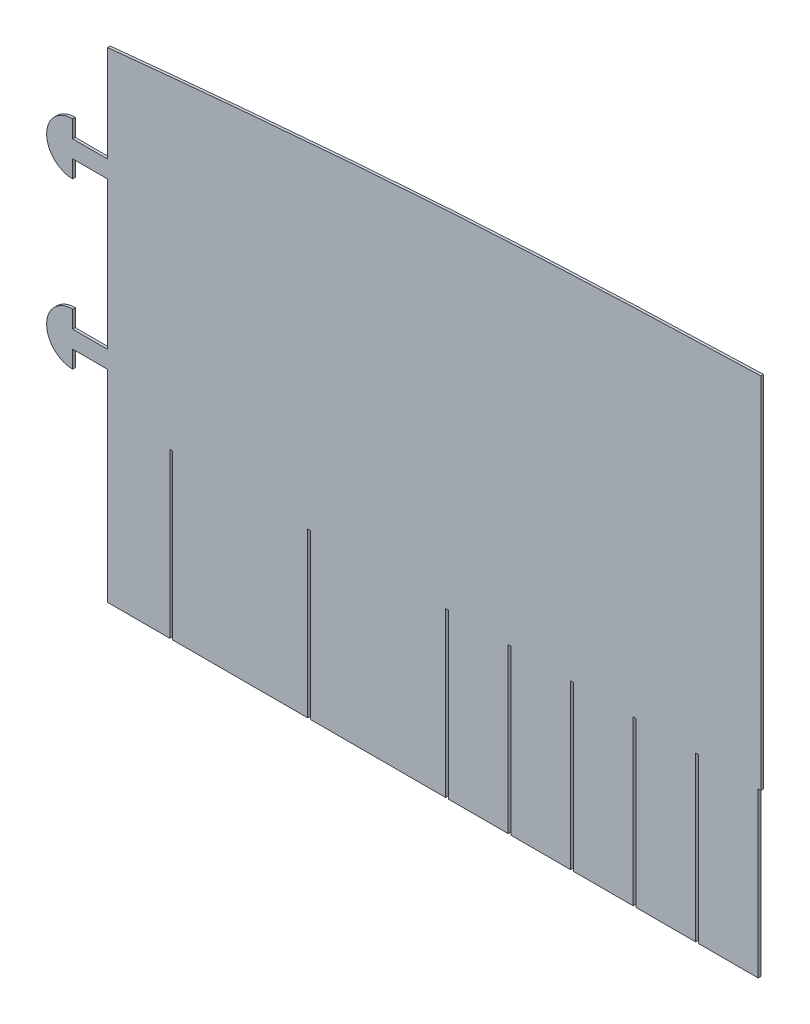
from build123d import *

# Parameters (mm, degrees)
BOSS_EXTRUDE1_DEPTH = 3


with BuildPart() as part:
    # Model → Boss-Extrude1 (new body)
    with BuildSketch(Plane.XY):
        with BuildLine():
            Line((1295.101037795, 0), (1295.101037795, 232.627781841))
            Line((1295.101037795, 232.627781841), (1254.901037796, 232.627781841))
            Line((1254.901037796, 232.627781841), (1254.901037796, 212.627781841))
            ThreePointArc((1254.901037796, 212.627781841), (1224.901037796, 242.627781841), (1254.901037796, 272.627781841))
            Line((1254.901037796, 272.627781841), (1254.901037796, 252.627781841))
            Line((1254.901037796, 252.627781841), (1295.101037795, 252.627781841))
            Line((1295.101037795, 252.627781841), (1295.101037795, 422.627781841))
            Line((1295.101037795, 422.627781841), (1254.901037796, 422.627781841))
            Line((1254.901037796, 422.627781841), (1254.901037796, 402.627781841))
            ThreePointArc((1254.901037796, 402.627781841), (1224.901037796, 432.627781841), (1254.901037796, 462.627781841))
            Line((1254.901037796, 462.627781841), (1254.901037796, 442.627781841))
            Line((1254.901037796, 442.627781841), (1295.101037795, 442.627781841))
            Line((1295.101037795, 442.627781841), (1295.101037795, 553.889357901))
            add(Edge.make_bspline(
                [(2048.11356374, 602.627781841), (1934.596406147, 599.111372984), (1718.604938145, 592.182424007), (1441.4869488, 568.541427312), (1295.101037795, 553.889357901)],
                knots=[0.03363534, 0.03363534, 0.03363534, 0.03363534, 0.070138481, 0.108742005, 0.108742005, 0.108742005, 0.108742005], degree=3))
            Line((2048.11356374, 602.627781841), (2048.11356374, 188.610331254))
            Line((2048.11356374, 188.610331254), (2045.113563742, 188.610331254))
            Line((2045.113563742, 188.610331254), (2045.113563742, 0))
            Line((2045.113563742, 0), (1976.071058553, 0))
            Line((1976.071058553, 0), (1976.071058553, 188.610331254))
            Line((1976.071058553, 188.610331254), (1973.071058559, 188.610331254))
            Line((1973.071058559, 188.610331254), (1973.071058559, 0))
            Line((1973.071058559, 0), (1904.028553364, 0))
            Line((1904.028553364, 0), (1904.028553364, 188.610331254))
            Line((1904.028553364, 188.610331254), (1901.028553364, 188.610331254))
            Line((1901.028553364, 188.610331254), (1901.028553364, 0))
            Line((1901.028553364, 0), (1831.986048175, 0))
            Line((1831.986048175, 0), (1831.986048175, 188.610331254))
            Line((1831.986048175, 188.610331254), (1828.986048175, 188.610331254))
            Line((1828.986048175, 188.610331254), (1828.986048175, 0))
            Line((1828.986048175, 0), (1759.943542987, 0))
            Line((1759.943542987, 0), (1759.943542987, 188.610331254))
            Line((1759.943542987, 188.610331254), (1756.943542987, 188.610331254))
            Line((1756.943542987, 188.610331254), (1756.943542987, 0))
            Line((1756.943542987, 0), (1687.901037798, 0))
            Line((1687.901037798, 0), (1687.901037798, 188.610331254))
            Line((1687.901037798, 188.610331254), (1684.901037802, 188.610331254))
            Line((1684.901037802, 188.610331254), (1684.901037802, 0))
            Line((1684.901037802, 0), (1528.901037796, 0))
            Line((1528.901037796, 0), (1528.901037796, 188.610331254))
            Line((1528.901037796, 188.610331254), (1525.901037796, 188.610331254))
            Line((1525.901037796, 188.610331254), (1525.901037796, 0))
            Line((1525.901037796, 0), (1369.901037796, 0))
            Line((1369.901037796, 0), (1369.901037796, 188.610331254))
            Line((1369.901037796, 188.610331254), (1366.901037796, 188.610331254))
            Line((1366.901037796, 188.610331254), (1366.901037796, 0))
            Line((1366.901037796, 0), (1295.101037795, 0))
        make_face()
    extrude(amount=BOSS_EXTRUDE1_DEPTH)


solid = part.part
